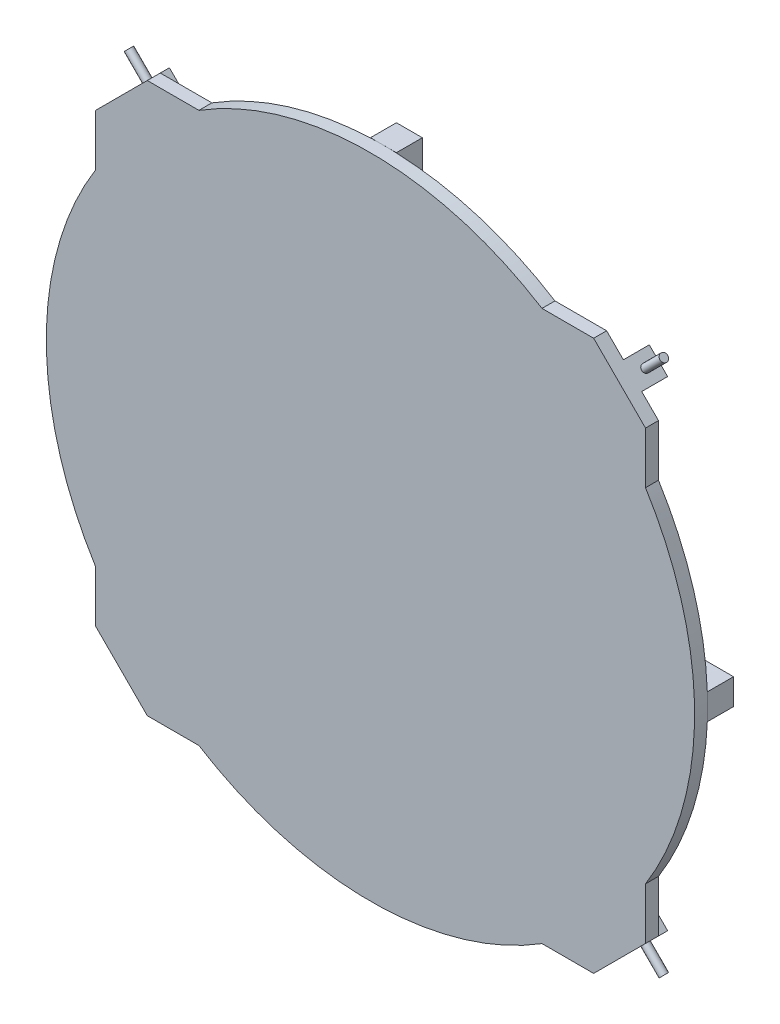
from build123d import *

# Parameters (mm, degrees)
BOSS_EXTRUDE2_DEPTH = 10
BOSS_EXTRUDE3_DEPTH = 20
SKETCH3_R           = 3
BOSS_EXTRUDE4_DEPTH = 20
SKETCH4_R           = 3
BOSS_EXTRUDE5_DEPTH = 20
SKETCH5_R           = 3
BOSS_EXTRUDE6_DEPTH = 20
BOSS_EXTRUDE7_START = 20
SKETCH8_R           = 3
BOSS_EXTRUDE7_DEPTH = 20


with BuildPart() as part:
    # Sketch1 → Boss-Extrude2 (new body)
    with BuildSketch(Plane.XY):
        with BuildLine():
            Line((-172.132034356, 212.132034356), (-132.287565553, 212.132034356))
            ThreePointArc((-132.287565553, 212.132034356), (0, 250), (132.287565553, 212.132034356))
            Line((132.287565553, 212.132034356), (172.132034356, 212.132034356))
            Line((172.132034356, 212.132034356), (212.132034356, 172.132034356))
            Line((212.132034356, 172.132034356), (212.132034356, 132.287565553))
            ThreePointArc((212.132034356, 132.287565553), (250, 0), (212.132034356, -132.287565553))
            Line((212.132034356, -132.287565553), (212.132034356, -172.132034356))
            Line((212.132034356, -172.132034356), (172.132034356, -212.132034356))
            Line((172.132034356, -212.132034356), (132.287565553, -212.132034356))
            ThreePointArc((132.287565553, -212.132034356), (0, -250), (-132.287565553, -212.132034356))
            Line((-132.287565553, -212.132034356), (-172.132034356, -212.132034356))
            Line((-172.132034356, -212.132034356), (-212.132034356, -172.132034356))
            Line((-212.132034356, -172.132034356), (-212.132034356, -132.287565553))
            ThreePointArc((-212.132034356, -132.287565553), (-250, 0), (-212.132034356, 132.287565553))
            Line((-212.132034356, 132.287565553), (-212.132034356, 172.132034356))
            Line((-212.132034356, 172.132034356), (-172.132034356, 212.132034356))
        make_face()
    extrude(amount=BOSS_EXTRUDE2_DEPTH)

    # Sketch2 → Boss-Extrude3 (add)
    with BuildSketch(Plane(origin=(0, 0, 0), x_dir=(-1, 0, 0), z_dir=(0, 0, -1))):
        Polygon((10, 250), (-10, 250), (-10, 24.142135624), (-185.060966544, 199.203102168), (-199.203102168, 185.060966544), (-24.142135624, 10), (-250, 10), (-250, -10), (-24.142135624, -10), (-199.203102168, -185.060966544), (-185.060966544, -199.203102168), (-10, -24.142135624), (-10, -249.799919936), (10, -249.799919936), (10, -24.142135624), (185.060966544, -199.203102168), (199.203102168, -185.060966544), (24.142135624, -10), (249.799919936, -10), (249.799919936, 10), (24.142135624, 10), (199.203102168, 185.060966544), (192.132034356, 192.132034356), (185.060966544, 199.203102168), (10, 24.142135624), align=None)
    extrude(amount=BOSS_EXTRUDE3_DEPTH)

    # Sketch3 → Boss-Extrude4 (add)
    with BuildSketch(Plane(origin=(192.132034356, 192.132034356, 0), x_dir=(0, 0, -1), z_dir=(0.7071067811865465, 0.7071067811865487, 0))):
        with Locations(Location((9.977178016, 0, 0), (0, 0, 90))):
            Circle(SKETCH3_R)
    extrude(amount=BOSS_EXTRUDE4_DEPTH)

    # Sketch4 → Boss-Extrude5 (add)
    with BuildSketch(Plane(origin=(-192.132034356, 192.132034356, 0), x_dir=(0, 0, 1), z_dir=(-0.707106781186549, 0.707106781186546, 0))):
        with Locations(Location((-10, 0, 0), (0, 0, 270))):
            Circle(SKETCH4_R)
    extrude(amount=BOSS_EXTRUDE5_DEPTH)

    # Sketch5 → Boss-Extrude6 (add)
    with BuildSketch(Plane(origin=(-192.132034356, -192.132034356, 0), x_dir=(0, 0, 1), z_dir=(-0.7071067811865456, -0.7071067811865495, 0))):
        with Locations(Location((-10, 0, 0), (0, 0, 90))):
            Circle(SKETCH5_R)
    extrude(amount=BOSS_EXTRUDE6_DEPTH)

    # Sketch8 → Boss-Extrude7 (add)
    with BuildSketch(Plane(origin=(192.132034356, -192.132034356, 0), x_dir=(0, 0, -1), z_dir=(0.7071067811865489, -0.7071067811865462, 0)).offset(BOSS_EXTRUDE7_START)):
        with Locations(Location((10, 0, 0), (0, 0, 270))):
            Circle(SKETCH8_R)
    extrude(amount=-BOSS_EXTRUDE7_DEPTH)


solid = part.part
